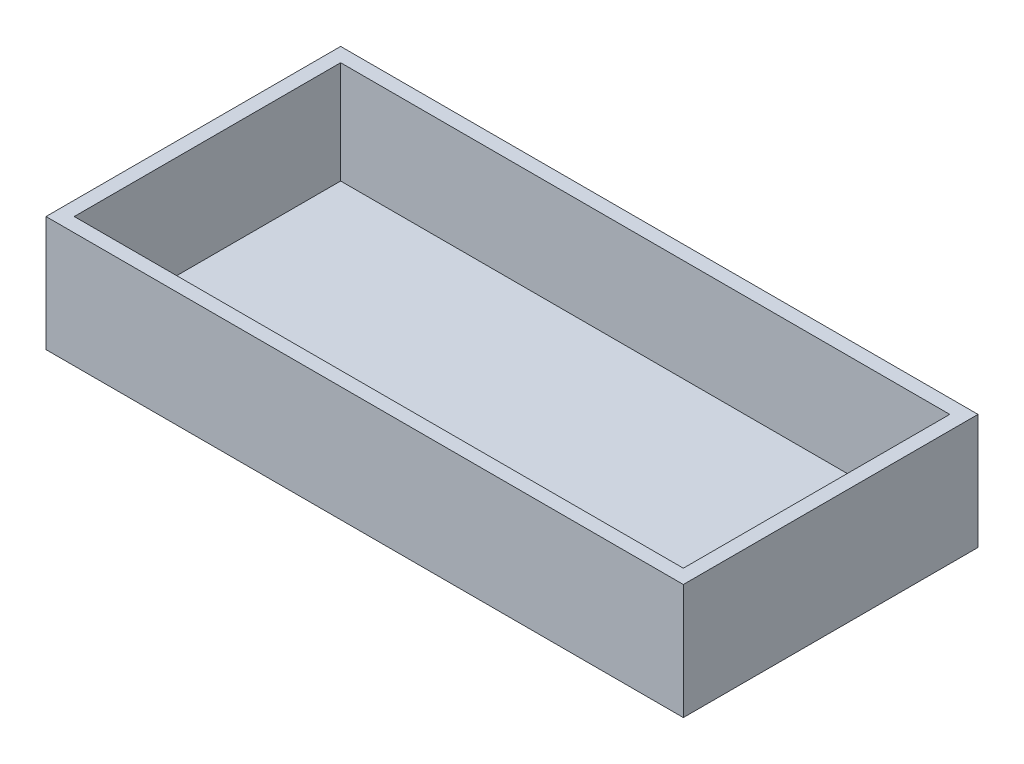
from build123d import *

# Parameters (mm, degrees)
SKETCH1_W           = 315.98108
SKETCH1_H           = 146.08048
SKETCH1_W_2         = 301.9806
SKETCH1_H_2         = 132.08
BOSS_EXTRUDE1_DEPTH = 50.8
SKETCH3_W           = 315.98108
SKETCH3_H           = 146.08048
BOSS_EXTRUDE2_DEPTH = 6.35


with BuildPart() as part:
    # Sketch1 → Boss-Extrude1 (new body)
    with BuildSketch(Plane(origin=(0, 0, 0), x_dir=(1, 0, 0), z_dir=(0, 1, 0))):
        Rectangle(SKETCH1_W, SKETCH1_H)
        Rectangle(SKETCH1_W_2, SKETCH1_H_2, mode=Mode.SUBTRACT)
    extrude(amount=BOSS_EXTRUDE1_DEPTH)

    # Sketch3 → Boss-Extrude2 (add)
    with BuildSketch(Plane.XZ):
        Rectangle(SKETCH3_W, SKETCH3_H)
    extrude(amount=BOSS_EXTRUDE2_DEPTH)


solid = part.part
